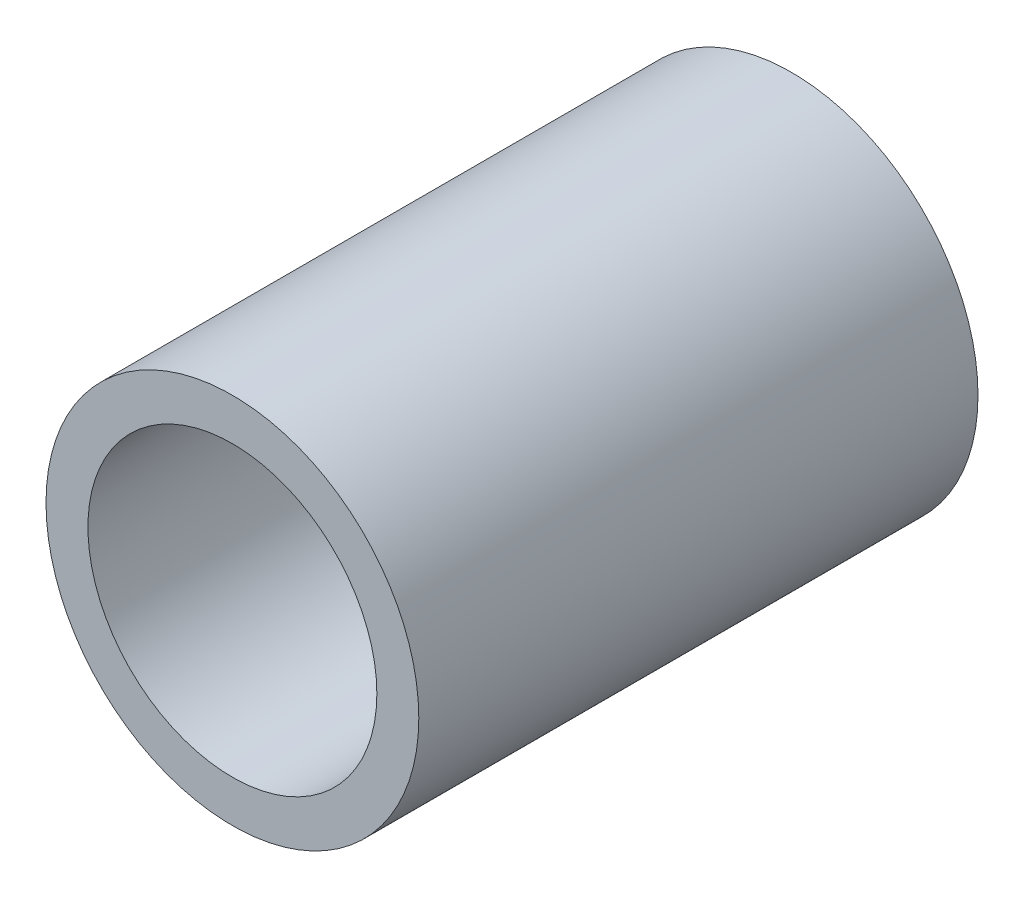
from build123d import *

# Parameters (mm, degrees)
SKETCH_1_R      = 1
SKETCH_1_R_2    = 0.775
EXTRUDE_1_DEPTH = 3


with BuildPart() as part:
    # Эскиз1 → Бобышка-Вытянуть1 (new body)
    with BuildSketch(Plane.XY):
        Circle(SKETCH_1_R)
        Circle(SKETCH_1_R_2, mode=Mode.SUBTRACT)
    extrude(amount=EXTRUDE_1_DEPTH)


solid = part.part
